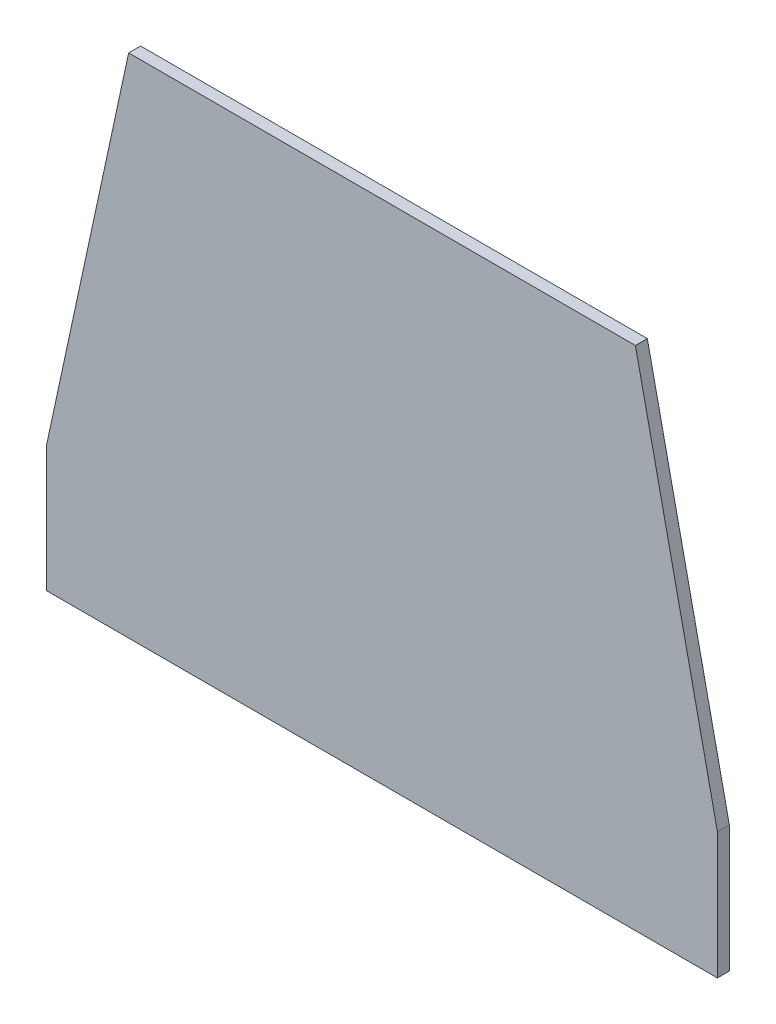
from build123d import *

# Parameters (mm, degrees)
SKETCH_2_R                        = 13
EXTRUDE_1214_DEPTH                = 16
SKETCH_3_R                        = 13
CUT_EXTRUDE_1_DEPTH               = 1129.120560933
PATTERN_LINEAR_1_COUNT            = 4
PATTERN_LINEAR_1_PITCH            = 80
PATTERN_LINEAR_1_COUNT_DIR2       = 3
PATTERN_LINEAR_1_PITCH_DIR2       = 80
PATTERN_LINEAR_2_COUNT            = 2
PATTERN_LINEAR_2_PITCH            = 360
PATTERN_LINEAR_2_COPY_1_SKETCH_R  = 13
PATTERN_LINEAR_2_COPY_1_DEPTH     = 1129.120560933
PATTERN_LINEAR_2_COPY_2_SKETCH_R  = 13
PATTERN_LINEAR_2_COPY_2_DEPTH     = 1129.120560933
PATTERN_LINEAR_2_COPY_3_SKETCH_R  = 13
PATTERN_LINEAR_2_COPY_3_DEPTH     = 1129.120560933
PATTERN_LINEAR_2_COPY_4_SKETCH_R  = 13
PATTERN_LINEAR_2_COPY_4_DEPTH     = 1129.120560933
PATTERN_LINEAR_2_COPY_5_SKETCH_R  = 13
PATTERN_LINEAR_2_COPY_5_DEPTH     = 1129.120560933
PATTERN_LINEAR_2_COPY_6_SKETCH_R  = 13
PATTERN_LINEAR_2_COPY_6_DEPTH     = 1129.120560933
PATTERN_LINEAR_2_COPY_7_SKETCH_R  = 13
PATTERN_LINEAR_2_COPY_7_DEPTH     = 1129.120560933
PATTERN_LINEAR_2_COPY_8_SKETCH_R  = 13
PATTERN_LINEAR_2_COPY_8_DEPTH     = 1129.120560933
PATTERN_LINEAR_2_COPY_9_SKETCH_R  = 13
PATTERN_LINEAR_2_COPY_9_DEPTH     = 1129.120560933
PATTERN_LINEAR_2_COPY_10_SKETCH_R = 13
PATTERN_LINEAR_2_COPY_10_DEPTH    = 1129.120560933
PATTERN_LINEAR_2_COPY_11_SKETCH_R = 13
PATTERN_LINEAR_2_COPY_11_DEPTH    = 1129.120560933
EXTRUDE_1_DEPTH                   = 16


with BuildPart() as part:
    # 草图2 → Extrude 1214 (new body)
    with BuildSketch(Plane.XY):
        Polygon((110, 680), (0, 170), (0, 0), (900, 0), (900, 170), (790, 680), align=None)
        with Locations((450, 50)):
            Circle(SKETCH_2_R, mode=Mode.SUBTRACT)
        with Locations((450, 130)):
            Circle(SKETCH_2_R, mode=Mode.SUBTRACT)
        with Locations((450, 210)):
            Circle(SKETCH_2_R, mode=Mode.SUBTRACT)
        with Locations((837.882573403, 45.038033192)):
            Circle(SKETCH_2_R, mode=Mode.SUBTRACT)
        with Locations(Location((62.117426597, 45.038033192, 0), (0, 0, 180))):
            Circle(SKETCH_2_R, mode=Mode.SUBTRACT)
        with Locations((506, 210)):
            Circle(SKETCH_2_R, mode=Mode.SUBTRACT)
        with Locations((506, 130)):
            Circle(SKETCH_2_R, mode=Mode.SUBTRACT)
        with Locations((506, 50)):
            Circle(SKETCH_2_R, mode=Mode.SUBTRACT)
        with Locations(Location((394, 50, 0), (0, 0, 180))):
            Circle(SKETCH_2_R, mode=Mode.SUBTRACT)
        with Locations(Location((394, 130, 0), (0, 0, 180))):
            Circle(SKETCH_2_R, mode=Mode.SUBTRACT)
        with Locations(Location((394, 210, 0), (0, 0, 180))):
            Circle(SKETCH_2_R, mode=Mode.SUBTRACT)
        with Locations((510, 310)):
            Circle(SKETCH_2_R, mode=Mode.SUBTRACT)
        with Locations((590, 310)):
            Circle(SKETCH_2_R, mode=Mode.SUBTRACT)
        with Locations(Location((310, 310, 0), (0, 0, 180))):
            Circle(SKETCH_2_R, mode=Mode.SUBTRACT)
        with Locations(Location((390, 310, 0), (0, 0, 180))):
            Circle(SKETCH_2_R, mode=Mode.SUBTRACT)
        with Locations((750.451236411, 282.431717421)):
            Circle(SKETCH_2_R, mode=Mode.SUBTRACT)
        with Locations((687.976264841, 232.4629479)):
            Circle(SKETCH_2_R, mode=Mode.SUBTRACT)
        with Locations((800.420005931, 219.956745851)):
            Circle(SKETCH_2_R, mode=Mode.SUBTRACT)
        with Locations((850.388775452, 157.481774282)):
            Circle(SKETCH_2_R, mode=Mode.SUBTRACT)
        with Locations((787.913803882, 107.513004761)):
            Circle(SKETCH_2_R, mode=Mode.SUBTRACT)
        with Locations((737.945034362, 169.987976331)):
            Circle(SKETCH_2_R, mode=Mode.SUBTRACT)
        with Locations(Location((725.438832313, 57.544235241, 0), (0, 0, 180))):
            Circle(SKETCH_2_R, mode=Mode.SUBTRACT)
        with Locations(Location((675.470062792, 120.01920681, 0), (0, 0, 180))):
            Circle(SKETCH_2_R, mode=Mode.SUBTRACT)
        with Locations(Location((625.501293272, 182.49417838, 0), (0, 0, 180))):
            Circle(SKETCH_2_R, mode=Mode.SUBTRACT)
        with Locations((274.498706728, 182.49417838)):
            Circle(SKETCH_2_R, mode=Mode.SUBTRACT)
        with Locations((224.529937208, 120.01920681)):
            Circle(SKETCH_2_R, mode=Mode.SUBTRACT)
        with Locations((174.561167687, 57.544235241)):
            Circle(SKETCH_2_R, mode=Mode.SUBTRACT)
        with Locations(Location((162.054965638, 169.987976331, 0), (0, 0, 180))):
            Circle(SKETCH_2_R, mode=Mode.SUBTRACT)
        with Locations(Location((112.086196118, 107.513004761, 0), (0, 0, 180))):
            Circle(SKETCH_2_R, mode=Mode.SUBTRACT)
        with Locations(Location((49.611224548, 157.481774282, 0), (0, 0, 180))):
            Circle(SKETCH_2_R, mode=Mode.SUBTRACT)
        with Locations(Location((99.579994069, 219.956745851, 0), (0, 0, 180))):
            Circle(SKETCH_2_R, mode=Mode.SUBTRACT)
        with Locations(Location((212.023735159, 232.4629479, 0), (0, 0, 180))):
            Circle(SKETCH_2_R, mode=Mode.SUBTRACT)
        with Locations(Location((149.548763589, 282.431717421, 0), (0, 0, 180))):
            Circle(SKETCH_2_R, mode=Mode.SUBTRACT)
    extrude(amount=EXTRUDE_1214_DEPTH)

    # 草图3 → 切除-拉伸1 (cut, through all)
    with BuildSketch(Plane.XY.offset(16)):
        with Locations((750, 610)):
            Circle(SKETCH_3_R)
    cut_extrude_1 = extrude(amount=-CUT_EXTRUDE_1_DEPTH, mode=Mode.SUBTRACT)

    # 阵列(线性)1: Cut-Extrude 1 4 × 3
    with Locations(*[(-i * PATTERN_LINEAR_1_PITCH, -j * PATTERN_LINEAR_1_PITCH_DIR2, 0) for i in range(PATTERN_LINEAR_1_COUNT) for j in range(PATTERN_LINEAR_1_COUNT_DIR2) if (i, j) != (0, 0)]):
        add(cut_extrude_1, mode=Mode.SUBTRACT)

    # 阵列(线性)2: 切除-拉伸1 ×2
    with Locations(*[(-i * PATTERN_LINEAR_2_PITCH, 0, 0) for i in range(1, PATTERN_LINEAR_2_COUNT)]):
        add(cut_extrude_1, mode=Mode.SUBTRACT)

    # 阵列(线性)2 copy 1 sketch → 阵列(线性)2 copy 1 (cut, through all)
    with BuildSketch(Plane(origin=(-360, -80, 16), x_dir=(1, 0, 0), z_dir=(0, 0, 1))):
        with Locations((750, 610)):
            Circle(PATTERN_LINEAR_2_COPY_1_SKETCH_R)
    extrude(amount=-PATTERN_LINEAR_2_COPY_1_DEPTH, mode=Mode.SUBTRACT)

    # 阵列(线性)2 copy 2 sketch → 阵列(线性)2 copy 2 (cut, through all)
    with BuildSketch(Plane(origin=(-360, -160, 16), x_dir=(1, 0, 0), z_dir=(0, 0, 1))):
        with Locations((750, 610)):
            Circle(PATTERN_LINEAR_2_COPY_2_SKETCH_R)
    extrude(amount=-PATTERN_LINEAR_2_COPY_2_DEPTH, mode=Mode.SUBTRACT)

    # 阵列(线性)2 copy 3 sketch → 阵列(线性)2 copy 3 (cut, through all)
    with BuildSketch(Plane(origin=(-440, 0, 16), x_dir=(1, 0, 0), z_dir=(0, 0, 1))):
        with Locations((750, 610)):
            Circle(PATTERN_LINEAR_2_COPY_3_SKETCH_R)
    extrude(amount=-PATTERN_LINEAR_2_COPY_3_DEPTH, mode=Mode.SUBTRACT)

    # 阵列(线性)2 copy 4 sketch → 阵列(线性)2 copy 4 (cut, through all)
    with BuildSketch(Plane(origin=(-440, -80, 16), x_dir=(1, 0, 0), z_dir=(0, 0, 1))):
        with Locations((750, 610)):
            Circle(PATTERN_LINEAR_2_COPY_4_SKETCH_R)
    extrude(amount=-PATTERN_LINEAR_2_COPY_4_DEPTH, mode=Mode.SUBTRACT)

    # 阵列(线性)2 copy 5 sketch → 阵列(线性)2 copy 5 (cut, through all)
    with BuildSketch(Plane(origin=(-440, -160, 16), x_dir=(1, 0, 0), z_dir=(0, 0, 1))):
        with Locations((750, 610)):
            Circle(PATTERN_LINEAR_2_COPY_5_SKETCH_R)
    extrude(amount=-PATTERN_LINEAR_2_COPY_5_DEPTH, mode=Mode.SUBTRACT)

    # 阵列(线性)2 copy 6 sketch → 阵列(线性)2 copy 6 (cut, through all)
    with BuildSketch(Plane(origin=(-520, 0, 16), x_dir=(1, 0, 0), z_dir=(0, 0, 1))):
        with Locations((750, 610)):
            Circle(PATTERN_LINEAR_2_COPY_6_SKETCH_R)
    extrude(amount=-PATTERN_LINEAR_2_COPY_6_DEPTH, mode=Mode.SUBTRACT)

    # 阵列(线性)2 copy 7 sketch → 阵列(线性)2 copy 7 (cut, through all)
    with BuildSketch(Plane(origin=(-520, -80, 16), x_dir=(1, 0, 0), z_dir=(0, 0, 1))):
        with Locations((750, 610)):
            Circle(PATTERN_LINEAR_2_COPY_7_SKETCH_R)
    extrude(amount=-PATTERN_LINEAR_2_COPY_7_DEPTH, mode=Mode.SUBTRACT)

    # 阵列(线性)2 copy 8 sketch → 阵列(线性)2 copy 8 (cut, through all)
    with BuildSketch(Plane(origin=(-520, -160, 16), x_dir=(1, 0, 0), z_dir=(0, 0, 1))):
        with Locations((750, 610)):
            Circle(PATTERN_LINEAR_2_COPY_8_SKETCH_R)
    extrude(amount=-PATTERN_LINEAR_2_COPY_8_DEPTH, mode=Mode.SUBTRACT)

    # 阵列(线性)2 copy 9 sketch → 阵列(线性)2 copy 9 (cut, through all)
    with BuildSketch(Plane(origin=(-600, 0, 16), x_dir=(1, 0, 0), z_dir=(0, 0, 1))):
        with Locations((750, 610)):
            Circle(PATTERN_LINEAR_2_COPY_9_SKETCH_R)
    extrude(amount=-PATTERN_LINEAR_2_COPY_9_DEPTH, mode=Mode.SUBTRACT)

    # 阵列(线性)2 copy 10 sketch → 阵列(线性)2 copy 10 (cut, through all)
    with BuildSketch(Plane(origin=(-600, -80, 16), x_dir=(1, 0, 0), z_dir=(0, 0, 1))):
        with Locations((750, 610)):
            Circle(PATTERN_LINEAR_2_COPY_10_SKETCH_R)
    extrude(amount=-PATTERN_LINEAR_2_COPY_10_DEPTH, mode=Mode.SUBTRACT)

    # 阵列(线性)2 copy 11 sketch → 阵列(线性)2 copy 11 (cut, through all)
    with BuildSketch(Plane(origin=(-600, -160, 16), x_dir=(1, 0, 0), z_dir=(0, 0, 1))):
        with Locations((750, 610)):
            Circle(PATTERN_LINEAR_2_COPY_11_SKETCH_R)
    extrude(amount=-PATTERN_LINEAR_2_COPY_11_DEPTH, mode=Mode.SUBTRACT)

    # 草图4 → 凸台-拉伸1 (add)
    with BuildSketch(Plane.XY.offset(16)):
        Polygon((110, 680), (790, 680), (900, 170), (900, 0), (0, 0), (0, 170), align=None)
    extrude(amount=-EXTRUDE_1_DEPTH)


solid = part.part
